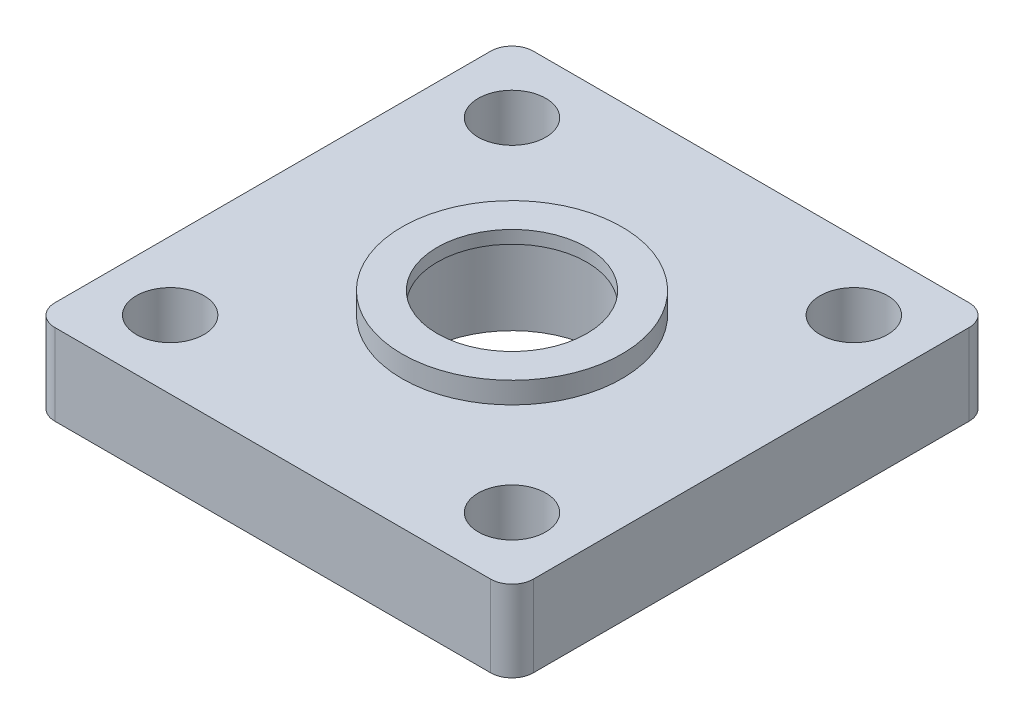
from build123d import *

# Parameters (mm, degrees)
SKETCH_1_W          = 112
SKETCH_1_H          = 112
EXTRUDE_1_DEPTH     = 19
SKETCH_2_R          = 25.75
EXTRUDE_2_DEPTH     = 5
SKETCH_3_W          = 100
SKETCH_3_H          = 100
EXTRUDE_3_DEPTH     = 5
SKETCH_4_R          = 30
CUT_EXTRUDE_1_DEPTH = 5
SKETCH_5_R          = 26
CUT_EXTRUDE_2_DEPTH = 1
SKETCH_6_R          = 21
CUT_EXTRUDE_3_DEPTH = 20
SKETCH_7_R          = 17.5
CUT_EXTRUDE_4_DEPTH = 85.338603261
SKETCH_8_R          = 7.9
CUT_EXTRUDE_5_DEPTH = 83.752643462
FILLET_1_R          = 5
FILLET_2_R          = 1


with BuildPart() as part:
    # 草图1 → 凸台-拉伸1 (new body)
    with BuildSketch(Plane(origin=(0, 0, 0), x_dir=(1, 0, 0), z_dir=(0, 1, 0))):
        Rectangle(SKETCH_1_W, SKETCH_1_H)
    extrude(amount=EXTRUDE_1_DEPTH)

    # 草图2 → 凸台-拉伸2 (add)
    with BuildSketch(Plane(origin=(0, 19, 0), x_dir=(1, 0, 0), z_dir=(0, 1, 0))):
        with Locations(Location((0, 0, 0), (0, 0, 270))):
            Circle(SKETCH_2_R)
    extrude(amount=EXTRUDE_2_DEPTH)

    # 草图3 → 凸台-拉伸3 (add)
    with BuildSketch(Plane.XZ):
        Rectangle(SKETCH_3_W, SKETCH_3_H)
    extrude(amount=EXTRUDE_3_DEPTH)

    # 草图4 → 切除-拉伸1 (cut)
    with BuildSketch(Plane.XZ.offset(5)):
        with Locations(Location((0, 0, 0), (0, 0, 270))):
            Circle(SKETCH_4_R)
    extrude(amount=-CUT_EXTRUDE_1_DEPTH, mode=Mode.SUBTRACT)

    # 草图5 → 切除-拉伸2 (cut)
    with BuildSketch(Plane.XZ):
        with Locations(Location((0, 0, 0), (0, 0, 270))):
            Circle(SKETCH_5_R)
    extrude(amount=-CUT_EXTRUDE_2_DEPTH, mode=Mode.SUBTRACT)

    # 草图6 → 切除-拉伸3 (cut)
    with BuildSketch(Plane.XZ.offset(-1)):
        with Locations(Location((0, 0, 0), (0, 0, 270))):
            Circle(SKETCH_6_R)
    extrude(amount=-CUT_EXTRUDE_3_DEPTH, mode=Mode.SUBTRACT)

    # 草图7 → 切除-拉伸4 (cut, through all)
    with BuildSketch(Plane(origin=(0, 24, 0), x_dir=(1, 0, 0), z_dir=(0, 1, 0))):
        with Locations(Location((0, 0, 0), (0, 0, 270))):
            Circle(SKETCH_7_R)
    extrude(amount=-CUT_EXTRUDE_4_DEPTH, mode=Mode.SUBTRACT)

    # 草图8 → 切除-拉伸5 (cut, through all)
    with BuildSketch(Plane(origin=(0, 19, 0), x_dir=(1, 0, 0), z_dir=(0, 1, 0))):
        with Locations(Location((-40, 40, 0), (0, 0, 270))):
            Circle(SKETCH_8_R)
        with Locations(Location((40, 40, 0), (0, 0, 270))):
            Circle(SKETCH_8_R)
        with Locations(Location((40, -40, 0), (0, 0, 270))):
            Circle(SKETCH_8_R)
        with Locations(Location((-40, -40, 0), (0, 0, 270))):
            Circle(SKETCH_8_R)
    extrude(amount=-CUT_EXTRUDE_5_DEPTH, mode=Mode.SUBTRACT)

    # 圆角1
    fillet_1_edges = [part.edges().sort_by_distance(p)[0] for p in [
        (50, -2.5, -50),
        (50, -2.5, 50),
        (-50, -2.5, 50),
        (-50, -2.5, -50),
        (56, 9.5, 56),
        (-56, 9.5, 56),
        (-56, 9.5, -56),
        (56, 9.5, -56),
    ]]
    fillet(fillet_1_edges, radius=FILLET_1_R)

    # 圆角2
    fillet_2_edges = [part.edges().sort_by_distance(p)[0] for p in [
        (0, 21, 21),
    ]]
    fillet(fillet_2_edges, radius=FILLET_2_R)


solid = part.part
